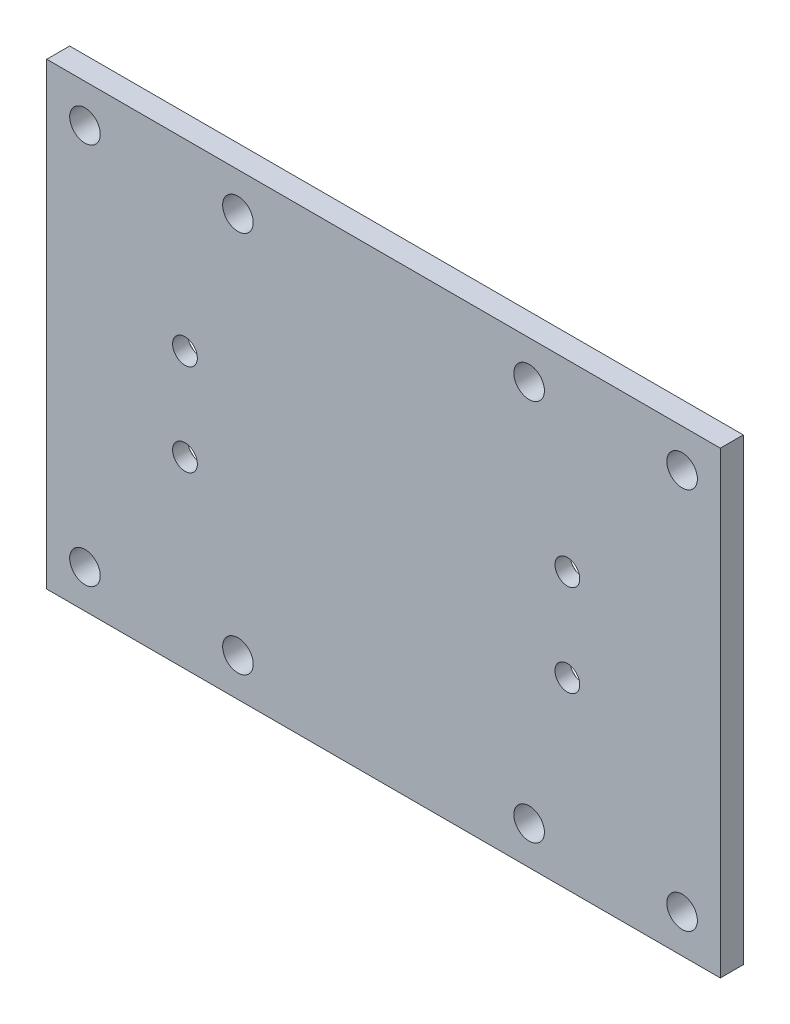
from build123d import *

# Parameters (mm, degrees)
SKETCH_1_W          = 88.07644651
SKETCH_1_H          = 60
EXTRUDE_1_DEPTH     = 3
SKETCH_2_R          = 2
CUT_EXTRUDE_1_DEPTH = 3
SKETCH_3_R          = 1.62
CUT_EXTRUDE_2_DEPTH = 3
SKETCH_4_R          = 3
CUT_EXTRUDE_3_DEPTH = 1


with BuildPart() as part:
    # 草图1 → 凸台-拉伸1 (new body)
    with BuildSketch(Plane.XY):
        with Locations((-120.442831111, 30)):
            Rectangle(SKETCH_1_W, SKETCH_1_H)
    extrude(amount=EXTRUDE_1_DEPTH)

    # 草图2 → 切除-拉伸1 (cut)
    with BuildSketch(Plane.XY.offset(3)):
        with Locations((-159.481054366, 5)):
            Circle(SKETCH_2_R)
        with Locations((-159.481054366, 55)):
            Circle(SKETCH_2_R)
        with Locations((-139.481054366, 5)):
            Circle(SKETCH_2_R)
        with Locations((-139.481054366, 55)):
            Circle(SKETCH_2_R)
        with Locations((-81.404607856, 5)):
            Circle(SKETCH_2_R)
        with Locations((-81.404607856, 55)):
            Circle(SKETCH_2_R)
        with Locations((-101.404607856, 55)):
            Circle(SKETCH_2_R)
        with Locations((-101.404607856, 5)):
            Circle(SKETCH_2_R)
    extrude(amount=-CUT_EXTRUDE_1_DEPTH, mode=Mode.SUBTRACT)

    # 草图3 → 切除-拉伸2 (cut)
    with BuildSketch(Plane(origin=(0, 0, 0), x_dir=(-1, 0, 0), z_dir=(0, 0, -1))):
        with Locations((96.404607856, 36)):
            Circle(SKETCH_3_R)
        with Locations((96.404607856, 24)):
            Circle(SKETCH_3_R)
        with Locations((146.404607856, 36)):
            Circle(SKETCH_3_R)
        with Locations((146.404607856, 24)):
            Circle(SKETCH_3_R)
    extrude(amount=-CUT_EXTRUDE_2_DEPTH, mode=Mode.SUBTRACT)

    # 草图4 → 切除-拉伸3 (cut)
    with BuildSketch(Plane(origin=(0, 0, 0), x_dir=(-1, 0, 0), z_dir=(0, 0, -1))):
        with Locations((96.404607856, 36)):
            Circle(SKETCH_4_R)
        with Locations((96.404607856, 24)):
            Circle(SKETCH_4_R)
        with Locations((146.404607856, 36)):
            Circle(SKETCH_4_R)
        with Locations((146.404607856, 24)):
            Circle(SKETCH_4_R)
    extrude(amount=-CUT_EXTRUDE_3_DEPTH, mode=Mode.SUBTRACT)


solid = part.part
